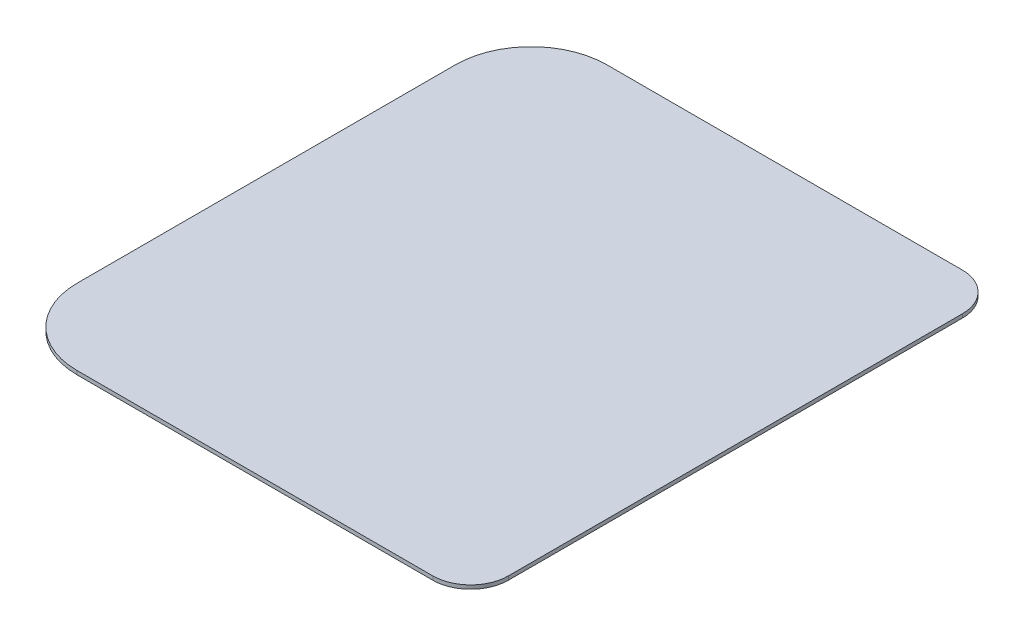
from build123d import *

# Parameters (mm, degrees)
BOSS_EXTRUDE1_DEPTH = 5


with BuildPart() as part:
    # Sketch1 → Boss-Extrude1 (new body)
    with BuildSketch(Plane(origin=(0, 0, 0), x_dir=(1, 0, 0), z_dir=(0, 1, 0))):
        with BuildLine():
            Line((-210, -350), (260, -350))
            ThreePointArc((260, -350), (295.355339059, -335.355339059), (310, -300))
            Line((310, -300), (310, 300))
            ThreePointArc((310, 300), (295.355339059, 335.355339059), (260, 350))
            Line((260, 350), (-210, 350))
            ThreePointArc((-210, 350), (-280.710678119, 320.710678119), (-310, 250))
            Line((-310, 250), (-310, -250))
            ThreePointArc((-310, -250), (-280.710678119, -320.710678119), (-210, -350))
        make_face()
    extrude(amount=BOSS_EXTRUDE1_DEPTH)


solid = part.part
